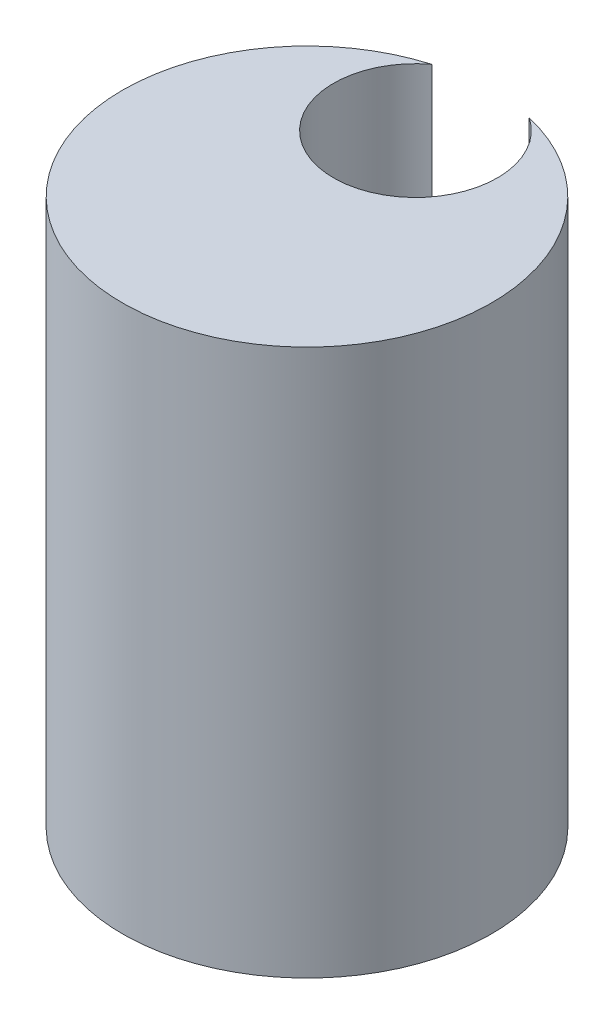
from build123d import *

# Parameters (mm, degrees)
SKETCH_1_R          = 1.35
EXTRUDE_1_DEPTH     = 4
SKETCH_2_R          = 0.6
CUT_EXTRUDE_1_DEPTH = 5.432268042


with BuildPart() as part:
    # 草图1 → 凸台-拉伸1 (new body)
    with BuildSketch(Plane(origin=(0, 0, 0), x_dir=(1, 0, 0), z_dir=(0, 1, 0))):
        with Locations(Location((0, 0, 0), (0, 0, 270))):
            Circle(SKETCH_1_R)
    extrude(amount=EXTRUDE_1_DEPTH)

    # 草图2 → 切除-拉伸1 (cut, through all)
    with BuildSketch(Plane(origin=(0, 4, 0), x_dir=(1, 0, 0), z_dir=(0, 1, 0))):
        with Locations((-0.021263906, 0.815244227)):
            Circle(SKETCH_2_R)
    extrude(amount=-CUT_EXTRUDE_1_DEPTH, mode=Mode.SUBTRACT)


solid = part.part
